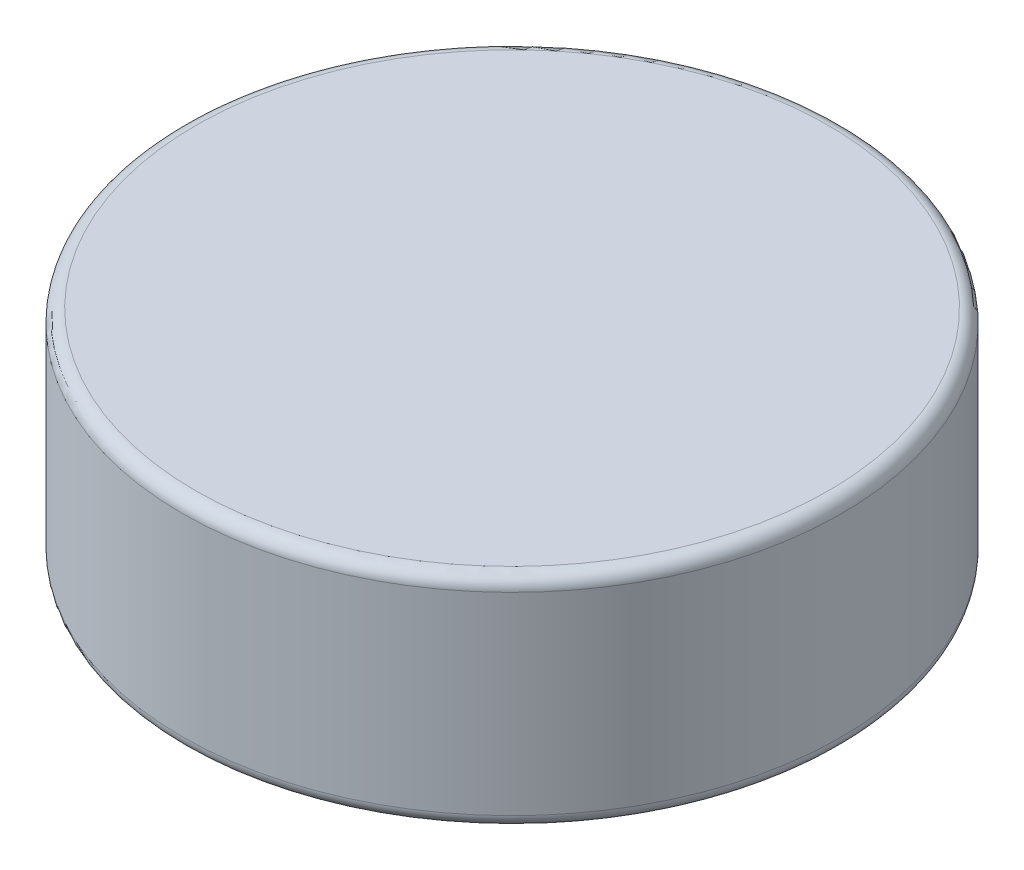
from build123d import *

# Parameters (mm, degrees)
SKETCH1_R           = 75
BOSS_EXTRUDE1_DEPTH = 25
FILLET1_R           = 3


with BuildPart() as part:
    # Sketch1 → Boss-Extrude1 (new, symmetric)
    with BuildSketch(Plane(origin=(0, 0, 0), x_dir=(1, 0, 0), z_dir=(0, 1, 0))):
        with Locations(Location((0, 0, 0), (0, 0, 270))):
            Circle(SKETCH1_R)
    extrude(amount=BOSS_EXTRUDE1_DEPTH, both=True)

    # Fillet1
    fillet1_edges = [part.edges().sort_by_distance(p)[0] for p in [
        (0, -25, -75),
        (0, 25, -75),
    ]]
    fillet(fillet1_edges, radius=FILLET1_R)


solid = part.part
